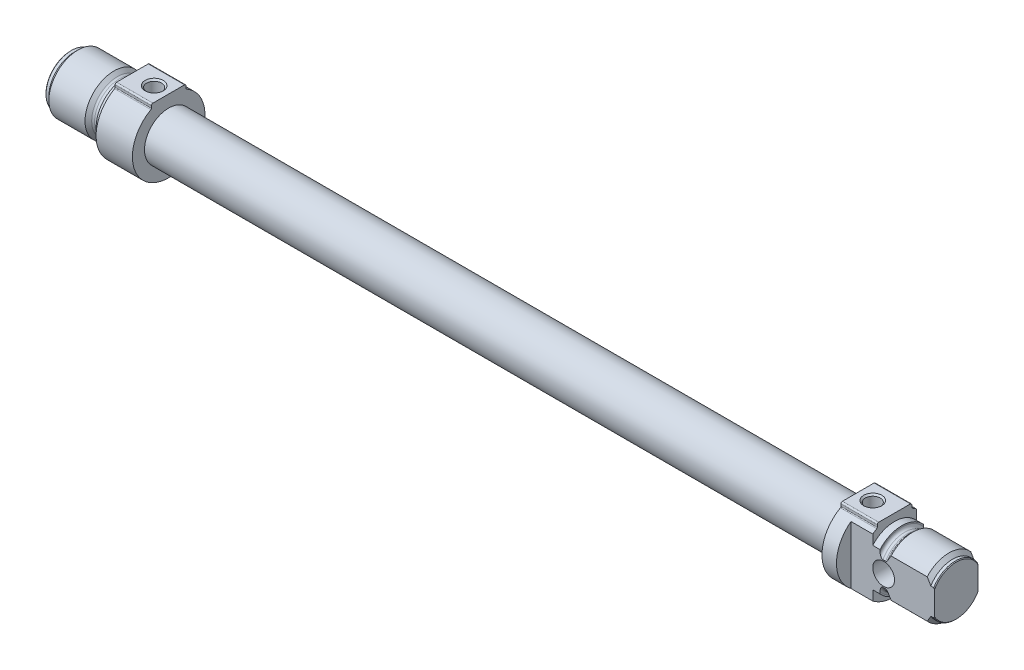
from build123d import *

# Parameters (mm, degrees)
AUFSATZ_LINEAR_AUSTRAGEN1_DEPTH      = 10
SKIZZE3_W                            = 190
SKIZZE3_H                            = 6.65
AUFSATZ_LINEAR_AUSTRAGEN2_DEPTH      = 10
SCHNITT_LINEAR_AUSTRAGEN1_DEPTH      = 10
SCHNITT_LINEAR_AUSTRAGEN1_DEPTH_BACK = 10
BOHRUNG1_D                           = 6
BOHRUNG2_D                           = 4.134
BOHRUNG2_DEPTH                       = 10
BOHRUNG2_CSINK_D                     = 5
BOHRUNG2_CSINK_ANGLE                 = 90
BOHRUNG3_D                           = 4.134
BOHRUNG3_DEPTH                       = 11
BOHRUNG3_CSINK_D                     = 5
BOHRUNG3_CSINK_ANGLE                 = 90
BOHRUNG3_TIP                         = 1.193383006


with BuildPart() as part:
    # Skizze1 → Rotation1 (revolve)
    with BuildSketch(Plane.XY):
        with BuildLine():
            Line((0, 0), (0, 6.8))
            Line((0, 6.8), (0.2, 7))
            Line((0.2, 7), (1, 7))
            Line((1, 7), (2, 8))
            Line((2, 8), (11.95, 8))
            Line((11.95, 8), (12.865685425, 7.084314575))
            ThreePointArc((12.865685425, 7.084314575), (13.125224104, 6.910896374), (13.43137085, 6.85))
            Line((13.43137085, 6.85), (14.2, 6.85))
            ThreePointArc((14.2, 6.85), (14.765685425, 7.084314575), (15, 7.65))
            Line((15, 7.65), (15, 8))
            Line((15, 8), (17, 8))
            Line((17, 8), (17, 0))
            Line((17, 0), (0, 0))
        make_face()
    revolve(axis=Axis((17, 0, 0), (-1, 0, 0)))

    # Skizze2 → Aufsatz-Linear austragen1 (add)
    with BuildSketch(Plane(origin=(17, 0, 0), x_dir=(0, 0, -1), z_dir=(1, 0, 0))):
        with BuildLine():
            Line((4.75, 8.977054082), (4.75, 9.6))
            ThreePointArc((4.75, 9.6), (4.632842712, 9.882842712), (4.35, 10))
            Line((4.35, 10), (-4.35, 10))
            ThreePointArc((-4.35, 10), (-4.632842712, 9.882842712), (-4.75, 9.6))
            Line((-4.75, 9.6), (-4.75, 8.977054082))
            ThreePointArc((-4.75, 8.977054082), (-4.791034545, 8.825604773), (-4.902912621, 8.715586488))
            ThreePointArc((-4.902912621, 8.715586488), (0, -10), (4.902912621, 8.715586488))
            ThreePointArc((4.902912621, 8.715586488), (4.791034545, 8.825604773), (4.75, 8.977054082))
        make_face()
    extrude(amount=AUFSATZ_LINEAR_AUSTRAGEN1_DEPTH)

    # Skizze3 → Rotation2 (revolve)
    with BuildSketch(Plane.XY):
        with Locations((122, 3.325)):
            Rectangle(SKIZZE3_W, SKIZZE3_H)
    revolve(axis=Axis((217, 0, 0), (-1, 0, 0)))

    # Skizze4 → Aufsatz-Linear austragen2 (add)
    with BuildSketch(Plane(origin=(217, 0, 0), x_dir=(0, 0, -1), z_dir=(1, 0, 0))):
        with BuildLine():
            Line((4.75, 8.977054082), (4.75, 9.6))
            ThreePointArc((4.75, 9.6), (4.632842712, 9.882842712), (4.35, 10))
            Line((4.35, 10), (-4.35, 10))
            ThreePointArc((-4.35, 10), (-4.632842712, 9.882842712), (-4.75, 9.6))
            Line((-4.75, 9.6), (-4.75, 8.977054082))
            ThreePointArc((-4.75, 8.977054082), (-4.791034545, 8.825604773), (-4.902912621, 8.715586488))
            ThreePointArc((-4.902912621, 8.715586488), (0, -10), (4.902912621, 8.715586488))
            ThreePointArc((4.902912621, 8.715586488), (4.791034545, 8.825604773), (4.75, 8.977054082))
        make_face()
    extrude(amount=AUFSATZ_LINEAR_AUSTRAGEN2_DEPTH)

    # Skizze5 → Rotation3 (revolve)
    with BuildSketch(Plane.XY):
        with BuildLine():
            Line((227, 0), (227, 8))
            Line((227, 8), (229, 8))
            Line((229, 8), (229, 7.65))
            ThreePointArc((229, 7.65), (229.234314575, 7.084314575), (229.8, 6.85))
            Line((229.8, 6.85), (230.56862915, 6.85))
            ThreePointArc((230.56862915, 6.85), (230.874775896, 6.910896374), (231.134314575, 7.084314575))
            Line((231.134314575, 7.084314575), (232.05, 8))
            Line((232.05, 8), (242, 8))
            Line((242, 8), (243, 7))
            Line((243, 7), (243.8, 7))
            Line((243.8, 7), (244, 6.8))
            Line((244, 6.8), (244, 0))
            Line((244, 0), (227, 0))
        make_face()
    revolve(axis=Axis((244, 0, 0), (-1, 0, 0)))

    # Skizze6 → Schnitt-Linear austragen1 (cut, two sides: drawn at the far end of the back side and taken through both)
    with BuildSketch(Plane(origin=(0, 0, 0), x_dir=(1, 0, 0), z_dir=(0, 1, 0)).offset(-SCHNITT_LINEAR_AUSTRAGEN1_DEPTH_BACK)):
        Polygon((221, 18), (221, 6), (244, 6), (244, -6), (221, -6), (221, -18), (256, -18), (256, 18), align=None)
    extrude(amount=SCHNITT_LINEAR_AUSTRAGEN1_DEPTH + SCHNITT_LINEAR_AUSTRAGEN1_DEPTH_BACK, mode=Mode.SUBTRACT)

    # Bohrung1 (through all)
    with Locations(Plane(origin=(0, 0, -6), x_dir=(-1, 0, 0), z_dir=(0, 0, -1))):
        with Locations((-230, 0)):
            Hole(BOHRUNG1_D / 2)

    # Bohrung2
    with Locations(Plane(origin=(0, 10, 0), x_dir=(1, 0, 0), z_dir=(0, 1, 0))):
        with Locations((23, 0)):
            CounterSinkHole(BOHRUNG2_D / 2, BOHRUNG2_CSINK_D / 2, depth=BOHRUNG2_DEPTH, counter_sink_angle=BOHRUNG2_CSINK_ANGLE)

    # Bohrung3
    with Locations(Plane(origin=(0, 10, 0), x_dir=(1, 0, 0), z_dir=(0, 1, 0))):
        with Locations((221, 0)):
            CounterSinkHole(BOHRUNG3_D / 2, BOHRUNG3_CSINK_D / 2, depth=BOHRUNG3_DEPTH, counter_sink_angle=BOHRUNG3_CSINK_ANGLE)
            with Locations((0, 0, -(BOHRUNG3_DEPTH + BOHRUNG3_TIP / 2))):  # 120° drill point
                Cone(0, BOHRUNG3_D / 2, BOHRUNG3_TIP, mode=Mode.SUBTRACT)

    # Skizze13 → Schnitt-Rotation1 (revolve, cut)
    with BuildSketch(Plane.XY):
        Polygon((-5, 0), (-5, 3), (37.3, 3), (37.3, 6), (200.3, 6), (200.3, 0), align=None)
    revolve(axis=Axis((200.3, 0, 0), (-1, 0, 0)), mode=Mode.SUBTRACT)


solid = part.part
